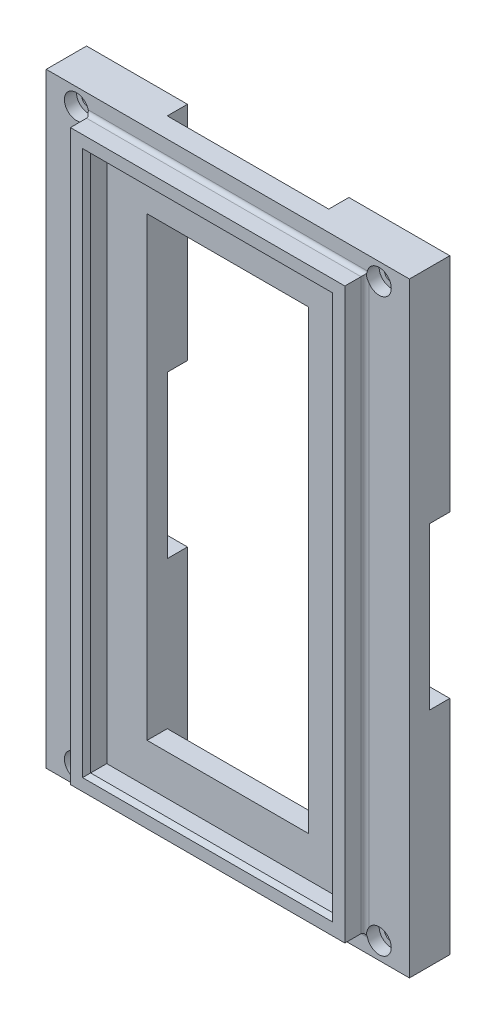
from build123d import *

# Parameters (mm, degrees)
SKETCH1_W           = 90
SKETCH1_H           = 150
BOSS_EXTRUDE1_DEPTH = 10
SKETCH2_W           = 40
SKETCH2_H           = 183.962493804
SKETCH2_W_2         = 287.968551507
SKETCH2_H_2         = 40
CUT_EXTRUDE2_DEPTH  = 5
SKETCH3_R           = 1.7
CUT_EXTRUDE3_DEPTH  = 12
SKETCH4_W           = 68
SKETCH4_H           = 141
SKETCH4_W_2         = 60
SKETCH4_H_2         = 133
BOSS_EXTRUDE2_DEPTH = 5
FILLET1_R           = 1
CHAMFER1_SIZE       = 1
SKETCH5_W           = 40
SKETCH5_H           = 113
CUT_EXTRUDE4_DEPTH  = 10
SKETCH6_R           = 3
SKETCH6_R_2         = 1.7
CUT_EXTRUDE5_DEPTH  = 3


with BuildPart() as part:
    # Sketch1 → Boss-Extrude1 (new body)
    with BuildSketch(Plane.XY):
        with Locations((152.4, 152.4)):
            Rectangle(SKETCH1_W, SKETCH1_H)
    extrude(amount=BOSS_EXTRUDE1_DEPTH)

    # Sketch2 → Cut-Extrude2 (cut)
    with BuildSketch(Plane(origin=(0, 0, 0), x_dir=(-1, 0, 0), z_dir=(0, 0, -1))):
        Polygon((-287.968551507, 162.4), (-287.968551507, 142.4), (-162.4, 142.4), (-162.4, 60.313941127), (-142.4, 60.313941127), (-142.4, 142.4), (0, 142.4), (0, 162.4), (-142.4, 162.4), (-142.4, 244.276434931), (-162.4, 244.276434931), (-162.4, 162.4), align=None)
        with Locations((-152.4, 152.295188029)):
            Rectangle(SKETCH2_W, SKETCH2_H)
        with Locations((-143.984275754, 152.4)):
            Rectangle(SKETCH2_W_2, SKETCH2_H_2)
    extrude(amount=-CUT_EXTRUDE2_DEPTH, mode=Mode.SUBTRACT)

    # Sketch3 → Cut-Extrude3 (cut)
    with BuildSketch(Plane.XY.offset(10)):
        with Locations((189.9, 81.65)):
            Circle(SKETCH3_R)
        with Locations((189.9, 223.15)):
            Circle(SKETCH3_R)
        with Locations((114.9, 223.15)):
            Circle(SKETCH3_R)
        with Locations((114.9, 81.65)):
            Circle(SKETCH3_R)
    extrude(amount=-CUT_EXTRUDE3_DEPTH, mode=Mode.SUBTRACT)

    # Sketch4 → Boss-Extrude2 (add)
    with BuildSketch(Plane.XY.offset(10)):
        with Locations((152.4, 152.4)):
            Rectangle(SKETCH4_W, SKETCH4_H)
        with Locations((152.4, 152.4)):
            Rectangle(SKETCH4_W_2, SKETCH4_H_2, mode=Mode.SUBTRACT)
    extrude(amount=BOSS_EXTRUDE2_DEPTH)

    # Fillet1
    fillet1_edges = [part.edges().sort_by_distance(p)[0] for p in [
        (118.4, 152.4, 10),
        (152.4, 81.9, 10),
        (186.4, 152.4, 10),
        (152.4, 222.9, 10),
    ]]
    fillet(fillet1_edges, radius=FILLET1_R)

    # Chamfer1
    chamfer1_edges = [part.edges().sort_by_distance(p)[0] for p in [
        (152.4, 85.9, 15),
        (182.4, 152.4, 15),
        (152.4, 218.9, 15),
        (122.4, 152.4, 15),
    ]]
    chamfer(chamfer1_edges, length=CHAMFER1_SIZE)

    # Sketch5 → Cut-Extrude4 (cut)
    with BuildSketch(Plane.XY.offset(10)):
        with Locations((152.4, 152.4)):
            Rectangle(SKETCH5_W, SKETCH5_H)
    extrude(amount=-CUT_EXTRUDE4_DEPTH, mode=Mode.SUBTRACT)

    # Sketch6 → Cut-Extrude5 (cut, symmetric)
    # profile 1 of 4: a face of its own
    with BuildSketch(Plane.XY.offset(10)):
        with Locations((114.9, 223.15)):
            Circle(SKETCH6_R)
        with Locations((114.9, 223.15)):
            Circle(SKETCH6_R_2, mode=Mode.SUBTRACT)
    # profile 2 of 4: a face of its own
    with BuildSketch(Plane.XY.offset(10)):
        with Locations((114.9, 81.65)):
            Circle(SKETCH6_R)
        with Locations((114.9, 81.65)):
            Circle(SKETCH6_R_2, mode=Mode.SUBTRACT)
    # profile 3 of 4: a face of its own
    with BuildSketch(Plane.XY.offset(10)):
        with Locations((189.9, 81.65)):
            Circle(SKETCH6_R)
        with Locations((189.9, 81.65)):
            Circle(SKETCH6_R_2, mode=Mode.SUBTRACT)
    # profile 4 of 4: a face of its own
    with BuildSketch(Plane.XY.offset(10)):
        with Locations((189.9, 223.15)):
            Circle(SKETCH6_R)
        with Locations((189.9, 223.15)):
            Circle(SKETCH6_R_2, mode=Mode.SUBTRACT)
    extrude(amount=CUT_EXTRUDE5_DEPTH, both=True, mode=Mode.SUBTRACT)


solid = part.part
